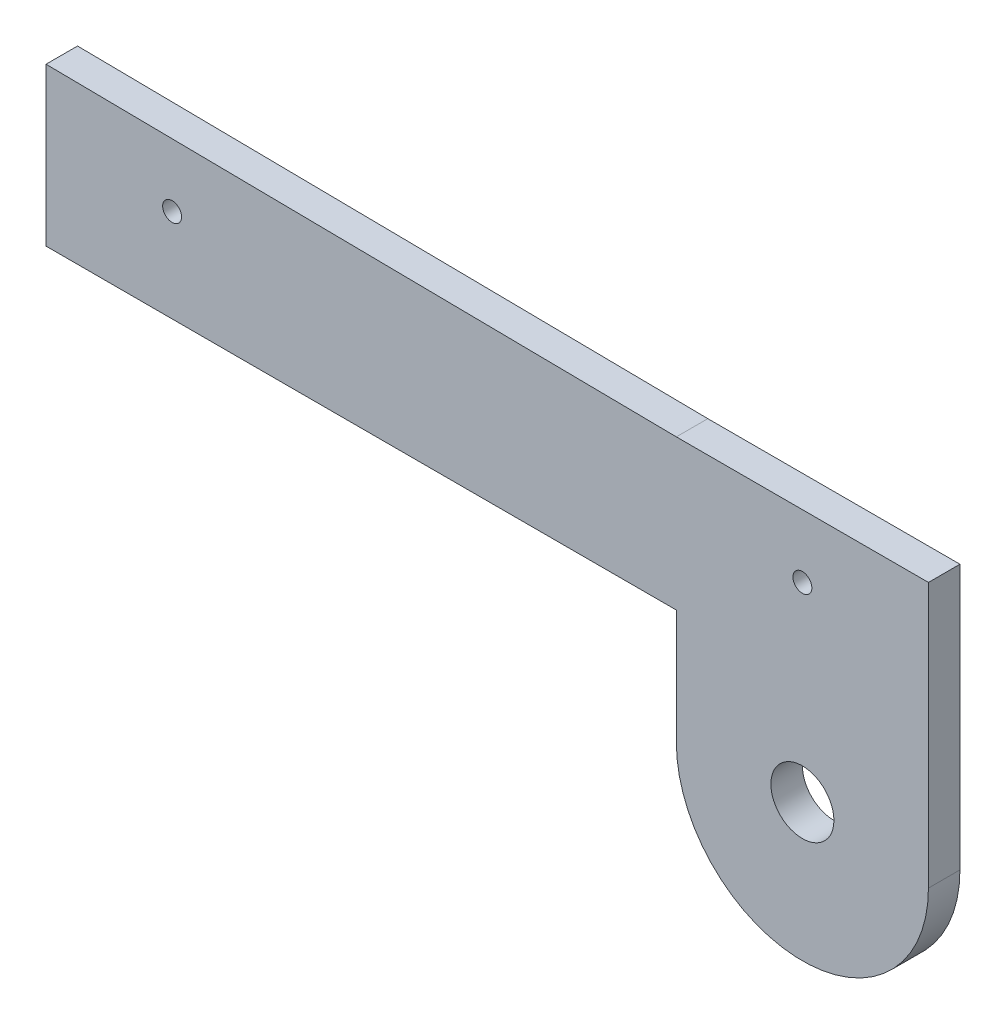
from build123d import *

# Parameters (mm, degrees)
SKETCH1_R               = 1.5
BOSS_EXTRUDE1_DEPTH     = 5
CUT_EXTRUDE1_DEPTH      = 37
CUT_EXTRUDE1_DEPTH_BACK = 24
SKETCH2_R               = 5


with BuildPart() as part:
    # Sketch1 → Boss-Extrude1 (new body)
    with BuildSketch(Plane.XY):
        with BuildLine():
            Line((-20, -76.707766284), (-20, -58.504148974))
            Line((-20, -58.504148974), (-120, -58.504148974))
            Line((-120, -58.504148974), (-120, -33.504148974))
            Line((-120, -33.504148974), (-20, -34.707766284))
            Line((-20, -34.707766284), (20, -34.707766284))
            Line((20, -34.707766284), (20, -76.707766284))
            ThreePointArc((20, -76.707766284), (0, -96.707766284), (-20, -76.707766284))
        make_face()
        with Locations((0, -44.707766284)):
            Circle(SKETCH1_R, mode=Mode.SUBTRACT)
        with Locations((-100, -43.745596757)):
            Circle(SKETCH1_R, mode=Mode.SUBTRACT)
    extrude(amount=BOSS_EXTRUDE1_DEPTH)

    # Sketch2 → Cut-Extrude1 (cut, two sides: drawn at the far end of the back side and taken through both)
    with BuildSketch(Plane.XY.offset(5).offset(-CUT_EXTRUDE1_DEPTH_BACK)):
        with Locations((0, -74.90788056)):
            Circle(SKETCH2_R)
    extrude(amount=CUT_EXTRUDE1_DEPTH + CUT_EXTRUDE1_DEPTH_BACK, mode=Mode.SUBTRACT)


solid = part.part
